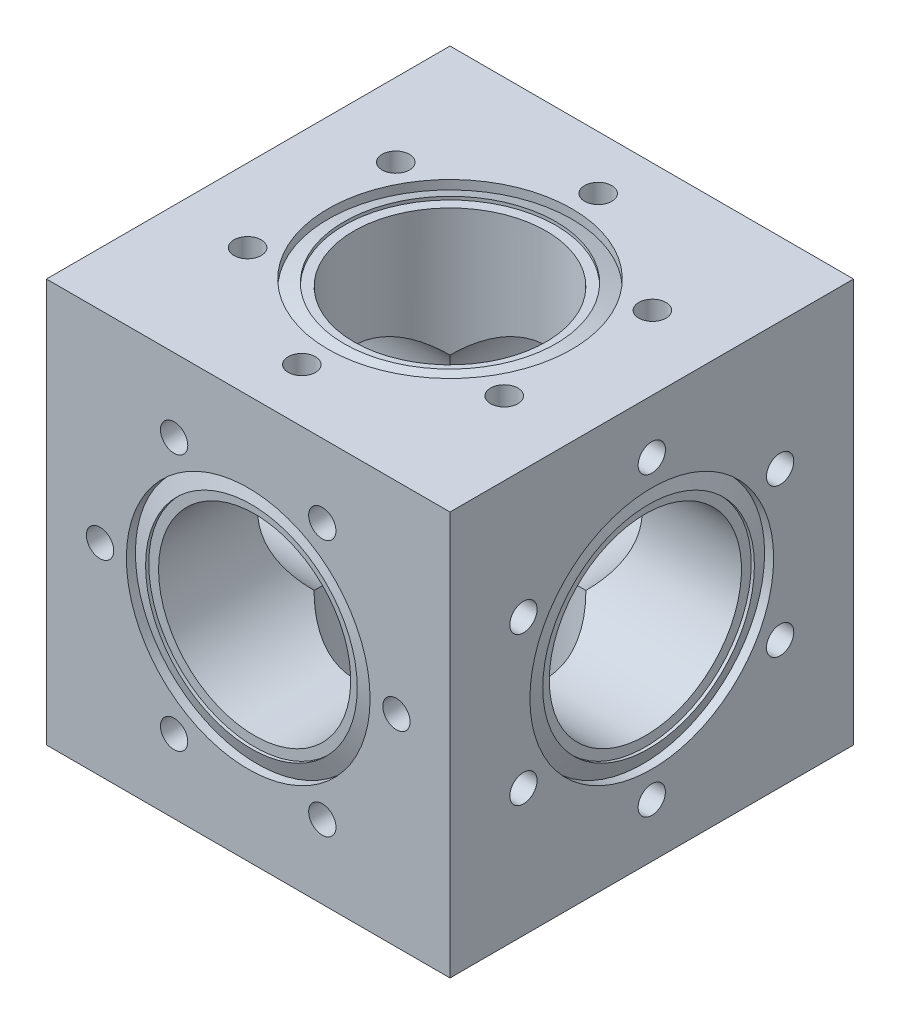
from build123d import *

# Parameters (mm, degrees)
SKETCH1_W           = 80
SKETCH1_H           = 80
BOSS_EXTRUDE1_DEPTH = 40
CIRPATTERN1_COUNT   = 6
CIRPATTERN2_COUNT   = 6
CIRPATTERN3_COUNT   = 6
CIRPATTERN4_COUNT   = 4
CIRPATTERN5_COUNT   = 4


with BuildPart() as part:
    # Sketch1 → Boss-Extrude1 (new, symmetric)
    with BuildSketch(Plane.XY):
        Rectangle(SKETCH1_W, SKETCH1_H)
    extrude(amount=BOSS_EXTRUDE1_DEPTH, both=True)

    # Sketch6 → Cut-Revolve1 (revolve, cut)
    with BuildSketch(Plane.XY):
        Polygon((40, 24.1554), (38.209394506, 24.1554), (39.365, 20.9804), (38.73, 20.9804), (38.73, 19.05), (0, 19.05), (0, 0), (40, 0), align=None)
    cut_revolve1 = revolve(axis=Axis((40, 0, 0), (1, 0, 0)), mode=Mode.SUBTRACT)

    # Sketch5 → Tapped Hole0 (revolve, cut)
    with BuildSketch(Plane(origin=(40, 29.3751, 0), x_dir=(0, 0, -1), z_dir=(0, 1, 0))):
        Polygon((0, 0), (0, 11.785388009), (2.705099913, 10.16), (2.705099913, 0), align=None)
    tapped_hole0 = revolve(axis=Axis((46.35, 29.3751, 0), (-1, 0, 0)), mode=Mode.SUBTRACT)

    # Sketch8 → Tapped Hole1 (revolve, cut)
    with BuildSketch(Plane(origin=(0, 40, -29.3751), x_dir=(0, 0, 1), z_dir=(1, 0, 0))):
        Polygon((0, 0), (0, 11.785388009), (2.705099913, 10.16), (2.705099913, 0), align=None)
    tapped_hole1 = revolve(axis=Axis((0, 46.35, -29.3751), (0, -1, 0)), mode=Mode.SUBTRACT)

    # Sketch10 → Tapped Hole2 (revolve, cut)
    with BuildSketch(Plane(origin=(29.3751, 0, 40), x_dir=(0, -1, 0), z_dir=(1, 0, 0))):
        Polygon((0, 0), (0, 11.785388009), (2.705099913, 10.16), (2.705099913, 0), align=None)
    tapped_hole2 = revolve(axis=Axis((29.3751, 0, 46.35), (0, 0, -1)), mode=Mode.SUBTRACT)

    # CirPattern1: Tapped Hole0 ×6 about axis
    cirpattern1_axis = Axis((-38.4175, 0, 0), (1, 0, 0))
    for i in range(1, CIRPATTERN1_COUNT):
        add(tapped_hole0.rotate(cirpattern1_axis, i * 360 / CIRPATTERN1_COUNT), mode=Mode.SUBTRACT)

    # CirPattern2: Tapped Hole1 ×6 about axis
    cirpattern2_axis = Axis((0, 38.4175, 0), (0, -1, 0))
    for i in range(1, CIRPATTERN2_COUNT):
        add(tapped_hole1.rotate(cirpattern2_axis, i * 360 / CIRPATTERN2_COUNT), mode=Mode.SUBTRACT)

    # CirPattern3: Tapped Hole2 ×6 about axis
    cirpattern3_axis = Axis((0, 0, 38.4175), (0, 0, -1))
    for i in range(1, CIRPATTERN3_COUNT):
        add(tapped_hole2.rotate(cirpattern3_axis, i * 360 / CIRPATTERN3_COUNT), mode=Mode.SUBTRACT)

    # CirPattern4: Cut-Revolve1 ×4 about axis
    cirpattern4_axis = Axis((0, 38.4175, 0), (0, -1, 0))
    for i in range(1, CIRPATTERN4_COUNT):
        add(cut_revolve1.rotate(cirpattern4_axis, i * 360 / CIRPATTERN4_COUNT), mode=Mode.SUBTRACT)

    # CirPattern5: Cut-Revolve1 ×4 about axis, 1 skipped
    cirpattern5_axis = Axis((0, 0, 38.4175), (0, 0, -1))
    add([cut_revolve1.rotate(cirpattern5_axis, i * 360 / CIRPATTERN5_COUNT) for i in range(1, CIRPATTERN5_COUNT) if i not in (2,)], mode=Mode.SUBTRACT)

    # Mirror1 copy 1 sketch → Mirror1 copy 1 (revolve, cut)
    with BuildSketch(Plane(origin=(14.68755, -25.439582839, -40), x_dir=(-0.8660254037844386, -0.5000000000000001, 0), z_dir=(0.5000000000000001, -0.8660254037844386, 0))):
        Polygon((0, 0), (0, -11.785388009), (2.705099913, -10.16), (2.705099913, 0), align=None)
    revolve(axis=Axis((14.68755, -25.439582839, -46.35), (0, 0, -1)), mode=Mode.SUBTRACT)

    # Mirror1 copy 2 sketch → Mirror1 copy 2 (revolve, cut)
    with BuildSketch(Plane(origin=(-14.68755, -25.439582839, -40), x_dir=(-0.8660254037844387, 0.4999999999999998, 0), z_dir=(-0.4999999999999998, -0.8660254037844387, 0))):
        Polygon((0, 0), (0, -11.785388009), (2.705099913, -10.16), (2.705099913, 0), align=None)
    revolve(axis=Axis((-14.68755, -25.439582839, -46.35), (0, 0, -1)), mode=Mode.SUBTRACT)

    # Mirror1 copy 3 sketch → Mirror1 copy 3 (revolve, cut)
    with BuildSketch(Plane(origin=(-29.3751, 0, -40), x_dir=(0, 1, 0), z_dir=(-1, 0, 0))):
        Polygon((0, 0), (0, -11.785388009), (2.705099913, -10.16), (2.705099913, 0), align=None)
    revolve(axis=Axis((-29.3751, 0, -46.35), (0, 0, -1)), mode=Mode.SUBTRACT)

    # Mirror1 copy 4 sketch → Mirror1 copy 4 (revolve, cut)
    with BuildSketch(Plane(origin=(-14.68755, 25.439582839, -40), x_dir=(0.8660254037844384, 0.5000000000000004, 0), z_dir=(-0.5000000000000004, 0.8660254037844384, 0))):
        Polygon((0, 0), (0, -11.785388009), (2.705099913, -10.16), (2.705099913, 0), align=None)
    revolve(axis=Axis((-14.68755, 25.439582839, -46.35), (0, 0, -1)), mode=Mode.SUBTRACT)

    # Mirror1 copy 5 sketch → Mirror1 copy 5 (revolve, cut)
    with BuildSketch(Plane(origin=(14.68755, 25.439582839, -40), x_dir=(0.8660254037844386, -0.5000000000000001, 0), z_dir=(0.5000000000000001, 0.8660254037844386, 0))):
        Polygon((0, 0), (0, -11.785388009), (2.705099913, -10.16), (2.705099913, 0), align=None)
    revolve(axis=Axis((14.68755, 25.439582839, -46.35), (0, 0, -1)), mode=Mode.SUBTRACT)

    # Mirror1 copy 6 sketch → Mirror1 copy 6 (revolve, cut)
    with BuildSketch(Plane(origin=(29.3751, 0, -40), x_dir=(0, -1, 0), z_dir=(1, 0, 0))):
        Polygon((0, 0), (0, -11.785388009), (2.705099913, -10.16), (2.705099913, 0), align=None)
    revolve(axis=Axis((29.3751, 0, -46.35), (0, 0, -1)), mode=Mode.SUBTRACT)

    # Mirror2 copy 1 sketch → Mirror2 copy 1 (revolve, cut)
    with BuildSketch(Plane(origin=(25.439582839, -40, -14.68755), x_dir=(-0.8660254037844386, 0, 0.5000000000000001), z_dir=(0.5000000000000001, 0, 0.8660254037844386))):
        Polygon((0, 0), (0, -11.785388009), (2.705099913, -10.16), (2.705099913, 0), align=None)
    revolve(axis=Axis((25.439582839, -46.35, -14.68755), (0, -1, 0)), mode=Mode.SUBTRACT)

    # Mirror2 copy 2 sketch → Mirror2 copy 2 (revolve, cut)
    with BuildSketch(Plane(origin=(25.439582839, -40, 14.68755), x_dir=(-0.8660254037844387, 0, -0.4999999999999998), z_dir=(-0.4999999999999998, 0, 0.8660254037844387))):
        Polygon((0, 0), (0, -11.785388009), (2.705099913, -10.16), (2.705099913, 0), align=None)
    revolve(axis=Axis((25.439582839, -46.35, 14.68755), (0, -1, 0)), mode=Mode.SUBTRACT)

    # Mirror2 copy 3 sketch → Mirror2 copy 3 (revolve, cut)
    with BuildSketch(Plane(origin=(0, -40, 29.3751), x_dir=(0, 0, -1), z_dir=(-1, 0, 0))):
        Polygon((0, 0), (0, -11.785388009), (2.705099913, -10.16), (2.705099913, 0), align=None)
    revolve(axis=Axis((0, -46.35, 29.3751), (0, -1, 0)), mode=Mode.SUBTRACT)

    # Mirror2 copy 4 sketch → Mirror2 copy 4 (revolve, cut)
    with BuildSketch(Plane(origin=(-25.439582839, -40, 14.68755), x_dir=(0.8660254037844384, 0, -0.5000000000000004), z_dir=(-0.5000000000000004, 0, -0.8660254037844384))):
        Polygon((0, 0), (0, -11.785388009), (2.705099913, -10.16), (2.705099913, 0), align=None)
    revolve(axis=Axis((-25.439582839, -46.35, 14.68755), (0, -1, 0)), mode=Mode.SUBTRACT)

    # Mirror2 copy 5 sketch → Mirror2 copy 5 (revolve, cut)
    with BuildSketch(Plane(origin=(-25.439582839, -40, -14.68755), x_dir=(0.8660254037844386, 0, 0.5000000000000001), z_dir=(0.5000000000000001, 0, -0.8660254037844386))):
        Polygon((0, 0), (0, -11.785388009), (2.705099913, -10.16), (2.705099913, 0), align=None)
    revolve(axis=Axis((-25.439582839, -46.35, -14.68755), (0, -1, 0)), mode=Mode.SUBTRACT)

    # Mirror2 copy 6 sketch → Mirror2 copy 6 (revolve, cut)
    with BuildSketch(Plane(origin=(0, -40, -29.3751), x_dir=(0, 0, 1), z_dir=(1, 0, 0))):
        Polygon((0, 0), (0, -11.785388009), (2.705099913, -10.16), (2.705099913, 0), align=None)
    revolve(axis=Axis((0, -46.35, -29.3751), (0, -1, 0)), mode=Mode.SUBTRACT)

    # Mirror3 copy 1 sketch → Mirror3 copy 1 (revolve, cut)
    with BuildSketch(Plane(origin=(-40, 14.68755, 25.439582839), x_dir=(0, 0.8660254037844386, -0.5000000000000001), z_dir=(0, 0.5000000000000001, 0.8660254037844386))):
        Polygon((0, 0), (0, -11.785388009), (2.705099913, -10.16), (2.705099913, 0), align=None)
    revolve(axis=Axis((-46.35, 14.68755, 25.439582839), (-1, 0, 0)), mode=Mode.SUBTRACT)

    # Mirror3 copy 2 sketch → Mirror3 copy 2 (revolve, cut)
    with BuildSketch(Plane(origin=(-40, -14.68755, 25.439582839), x_dir=(0, 0.8660254037844387, 0.4999999999999998), z_dir=(0, -0.4999999999999998, 0.8660254037844387))):
        Polygon((0, 0), (0, -11.785388009), (2.705099913, -10.16), (2.705099913, 0), align=None)
    revolve(axis=Axis((-46.35, -14.68755, 25.439582839), (-1, 0, 0)), mode=Mode.SUBTRACT)

    # Mirror3 copy 3 sketch → Mirror3 copy 3 (revolve, cut)
    with BuildSketch(Plane(origin=(-40, -29.3751, 0), x_dir=(0, 0, 1), z_dir=(0, -1, 0))):
        Polygon((0, 0), (0, -11.785388009), (2.705099913, -10.16), (2.705099913, 0), align=None)
    revolve(axis=Axis((-46.35, -29.3751, 0), (-1, 0, 0)), mode=Mode.SUBTRACT)

    # Mirror3 copy 4 sketch → Mirror3 copy 4 (revolve, cut)
    with BuildSketch(Plane(origin=(-40, -14.68755, -25.439582839), x_dir=(0, -0.8660254037844384, 0.5000000000000004), z_dir=(0, -0.5000000000000004, -0.8660254037844384))):
        Polygon((0, 0), (0, -11.785388009), (2.705099913, -10.16), (2.705099913, 0), align=None)
    revolve(axis=Axis((-46.35, -14.68755, -25.439582839), (-1, 0, 0)), mode=Mode.SUBTRACT)

    # Mirror3 copy 5 sketch → Mirror3 copy 5 (revolve, cut)
    with BuildSketch(Plane(origin=(-40, 14.68755, -25.439582839), x_dir=(0, -0.8660254037844386, -0.5000000000000001), z_dir=(0, 0.5000000000000001, -0.8660254037844386))):
        Polygon((0, 0), (0, -11.785388009), (2.705099913, -10.16), (2.705099913, 0), align=None)
    revolve(axis=Axis((-46.35, 14.68755, -25.439582839), (-1, 0, 0)), mode=Mode.SUBTRACT)

    # Mirror3 copy 6 sketch → Mirror3 copy 6 (revolve, cut)
    with BuildSketch(Plane(origin=(-40, 29.3751, 0), x_dir=(0, 0, -1), z_dir=(0, 1, 0))):
        Polygon((0, 0), (0, -11.785388009), (2.705099913, -10.16), (2.705099913, 0), align=None)
    revolve(axis=Axis((-46.35, 29.3751, 0), (-1, 0, 0)), mode=Mode.SUBTRACT)


solid = part.part
